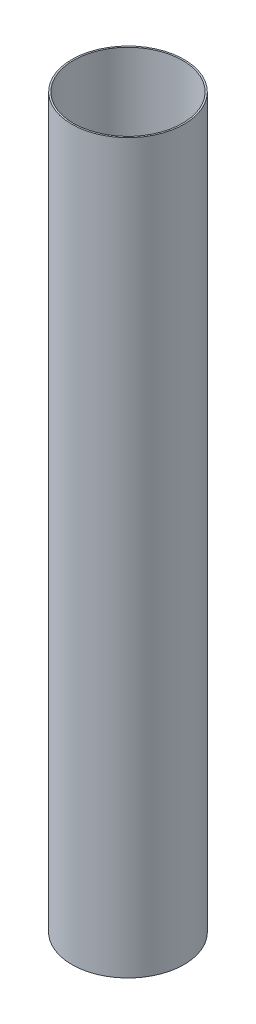
from build123d import *

# Parameters (mm, degrees)
SKETCH1_R           = 78.359
SKETCH1_R_2         = 76.2
BOSS_EXTRUDE1_DEPTH = 1016


with BuildPart() as part:
    # Sketch1 → Boss-Extrude1 (new body)
    with BuildSketch(Plane(origin=(0, 0, 0), x_dir=(1, 0, 0), z_dir=(0, 1, 0))):
        with Locations(Location((0, 0, 0), (0, 0, 270))):
            Circle(SKETCH1_R)
        with Locations(Location((0, 0, 0), (0, 0, 270))):
            Circle(SKETCH1_R_2, mode=Mode.SUBTRACT)
    extrude(amount=BOSS_EXTRUDE1_DEPTH)


solid = part.part
